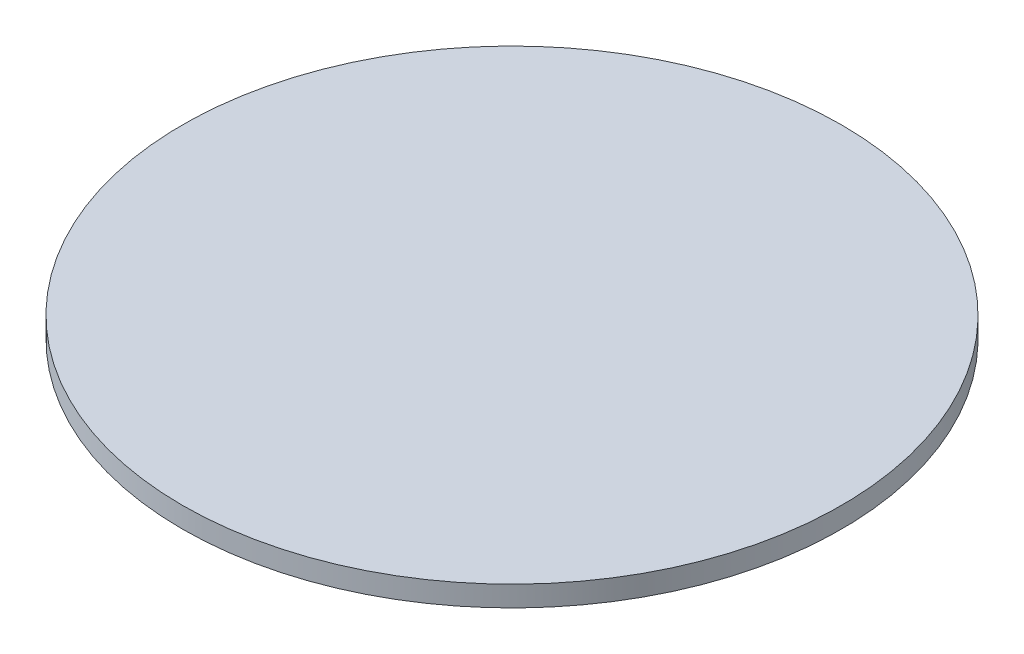
from build123d import *

# Parameters (mm, degrees)
SKETCH1_R           = 16
BOSS_EXTRUDE1_DEPTH = 1


with BuildPart() as part:
    # Sketch1 → Boss-Extrude1 (new body)
    with BuildSketch(Plane(origin=(0, 0, 0), x_dir=(1, 0, 0), z_dir=(0, 1, 0))):
        with Locations(Location((0, 0, 0), (0, 0, 270))):
            Circle(SKETCH1_R)
    extrude(amount=BOSS_EXTRUDE1_DEPTH)


solid = part.part
